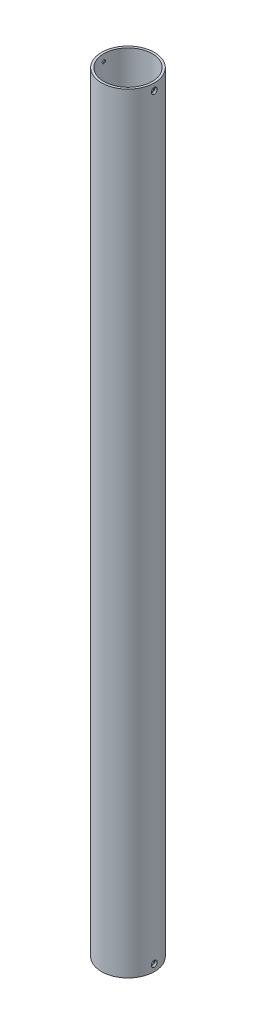
from build123d import *

# Parameters (mm, degrees)
SKETCH1_R                                    = 19.05
SKETCH1_R_2                                  = 17.4244
BOSS_EXTRUDE1_DEPTH                          = 555
CSK_FOR_M2_COUNTERSUNK_FLAT_HEAD_SCR_2_COUNT = 2
CSK_FOR_M2_COUNTERSUNK_FLAT_HEAD_SCR_2_PITCH = 545
CIRPATTERN2_COUNT                            = 2


with BuildPart() as part:
    # Sketch1 → Boss-Extrude1 (new body)
    with BuildSketch(Plane(origin=(0, 0, 0), x_dir=(1, 0, 0), z_dir=(0, 1, 0))):
        with Locations(Location((0, 0, 0), (0, 0, 270))):
            Circle(SKETCH1_R)
        with Locations(Location((0, 0, 0), (0, 0, 270))):
            Circle(SKETCH1_R_2, mode=Mode.SUBTRACT)
    extrude(amount=BOSS_EXTRUDE1_DEPTH)

    # Sketch44 → CSK for M2 Countersunk Flat Head Screw10 (revolve, cut)
    with BuildSketch(Plane(origin=(19.05, 5, 0), x_dir=(0, 0, -1), z_dir=(0, 1, 0))):
        Polygon((0, 0), (0, 10.721032743), (1.2, 10), (1.2, 1), (2.2, 0), align=None)
    csk_for_m2_countersunk_flat_head_screw10 = revolve(axis=Axis((25.4, 5, 0), (-1, 0, 0)), mode=Mode.SUBTRACT)

    # CSK for M2 Countersunk Flat Head Scr 2: CSK for M2 Countersunk Flat Head Screw10 ×2
    with Locations(*[(0, i * CSK_FOR_M2_COUNTERSUNK_FLAT_HEAD_SCR_2_PITCH, 0) for i in range(1, CSK_FOR_M2_COUNTERSUNK_FLAT_HEAD_SCR_2_COUNT)]):
        add(csk_for_m2_countersunk_flat_head_screw10, mode=Mode.SUBTRACT)

    # CirPattern2: CSK for M2 Countersunk Flat Head Screw10 ×2 about axis
    cirpattern2_axis = Axis((0, 555, 0), (0, 1, 0))
    for i in range(1, CIRPATTERN2_COUNT):
        add(csk_for_m2_countersunk_flat_head_screw10.rotate(cirpattern2_axis, i * 360 / CIRPATTERN2_COUNT), mode=Mode.SUBTRACT)

    # CirPattern2 copy 1 sketch → CirPattern2 copy 1 (revolve, cut)
    with BuildSketch(Plane(origin=(-19.05, 550, 0), x_dir=(0, 0, 1), z_dir=(0, 1, 0))):
        Polygon((0, 0), (0, 10.721032743), (1.2, 10), (1.2, 1), (2.2, 0), align=None)
    revolve(axis=Axis((-25.4, 550, 0), (1, 0, 0)), mode=Mode.SUBTRACT)


solid = part.part
